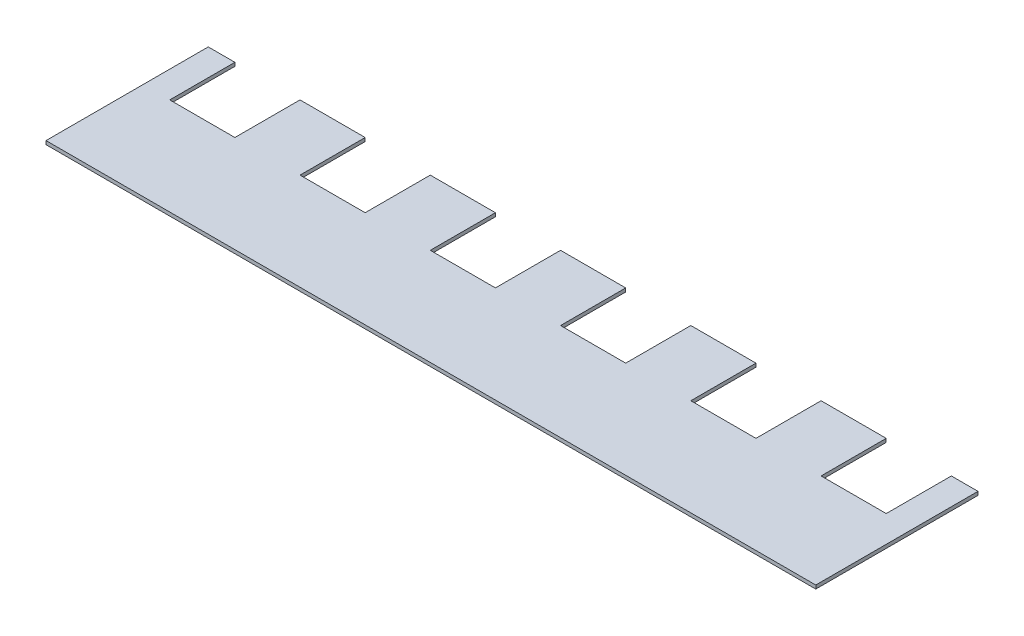
from build123d import *

# Parameters (mm, degrees)
SKETCH1_W               = 650
SKETCH1_H               = 137
BOSS_EXTRUDE1_DEPTH     = 3
CUT_EXTRUDE2_DEPTH      = 598.701122593
CUT_EXTRUDE2_DEPTH_BACK = 598.701122593
SKETCH2_W               = 55
SKETCH2_H               = 55
SKETCH3_W               = 55
SKETCH3_H               = 55
CUT_EXTRUDE3_DEPTH      = 598.701122593


with BuildPart() as part:
    # Sketch1 → Boss-Extrude1 (new body)
    with BuildSketch(Plane(origin=(0, 0, 0), x_dir=(1, 0, 0), z_dir=(0, 1, 0))):
        with Locations((262.487315064, 41.483119558)):
            Rectangle(SKETCH1_W, SKETCH1_H)
    extrude(amount=BOSS_EXTRUDE1_DEPTH)

    # Sketch2 → Cut-Extrude2 (cut, two sides: drawn at the far end of the back side and taken through both)
    with BuildSketch(Plane(origin=(0, 0, 0), x_dir=(1, 0, 0), z_dir=(0, 1, 0)).offset(-CUT_EXTRUDE2_DEPTH_BACK)):
        with Locations((97.487315064, 82.483119558)):
            Rectangle(SKETCH2_W, SKETCH2_H)
        with Locations((207.487315064, 82.483119558)):
            Rectangle(SKETCH2_W, SKETCH2_H)
        with Locations((317.487315064, 82.483119558)):
            Rectangle(SKETCH2_W, SKETCH2_H)
        with Locations((427.487315064, 82.483119558)):
            Rectangle(SKETCH2_W, SKETCH2_H)
        with Locations((537.487315064, 82.483119558)):
            Rectangle(SKETCH2_W, SKETCH2_H)
    extrude(amount=CUT_EXTRUDE2_DEPTH + CUT_EXTRUDE2_DEPTH_BACK, mode=Mode.SUBTRACT)

    # Sketch3 → Cut-Extrude3 (cut, through all)
    with BuildSketch(Plane(origin=(0, 3, 0), x_dir=(1, 0, 0), z_dir=(0, 1, 0))):
        with Locations((-12.512684936, 82.483119558)):
            Rectangle(SKETCH3_W, SKETCH3_H)
    extrude(amount=-CUT_EXTRUDE3_DEPTH, mode=Mode.SUBTRACT)


solid = part.part
